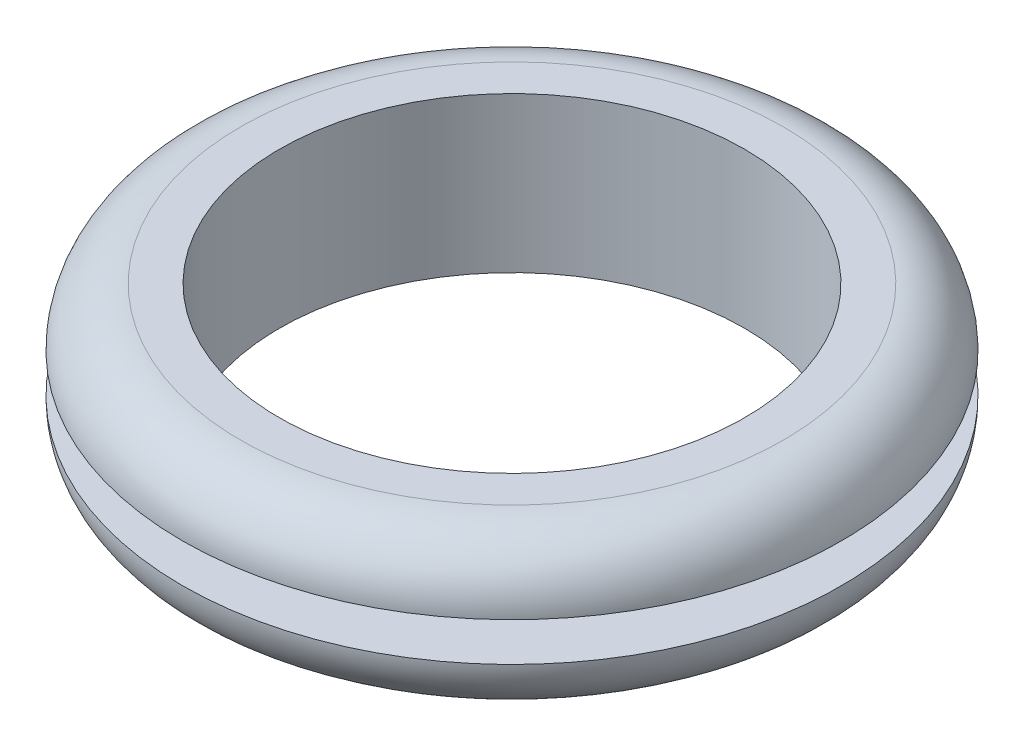
from build123d import *


with BuildPart() as part:
    # Sketch2 → Revolve1 (revolve)
    with BuildSketch(Plane(origin=(0, 0, 0), x_dir=(0, 0, -1), z_dir=(1, 0, 0)), mode=Mode.PRIVATE) as revolve1_sk:
        with BuildLine():
            Line((-19.05, -6.35), (-19.05, 6.35))
            Line((-19.05, 6.35), (-22.225, 6.35))
            ThreePointArc((-22.225, 6.35), (-25.592596045, 4.955096045), (-26.9875, 1.5875))
            Line((-26.9875, 1.5875), (-22.225, 1.5875))
            Line((-22.225, 1.5875), (-22.225, -1.5875))
            Line((-22.225, -1.5875), (-26.9875, -1.5875))
            ThreePointArc((-26.9875, -1.5875), (-25.592596045, -4.955096045), (-22.225, -6.35))
            Line((-22.225, -6.35), (-19.05, -6.35))
        make_face()
    revolve(revolve1_sk.sketch.rotate(Axis((0, -6.35, 0), (0, 1, 0)), 180), axis=Axis((0, -6.35, 0), (0, 1, 0)))


solid = part.part
